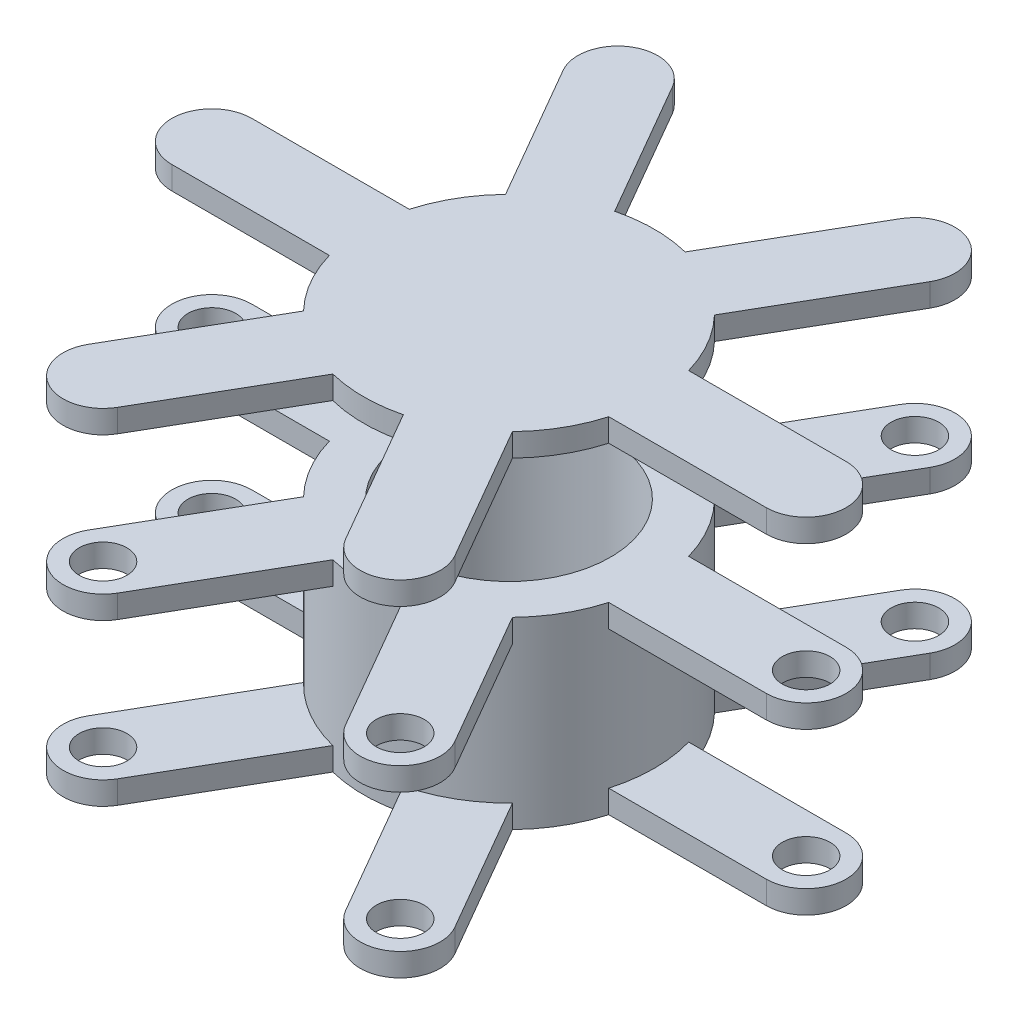
from build123d import *

# Parameters (mm, degrees)
SKETCH1_R           = 44.14652409
BOSS_EXTRUDE1_DEPTH = 70
SKETCH1_3_R         = 10.392805584
BOSS_EXTRUDE2_DEPTH = 10
SKETCH5_R           = 10.392805584
SKETCH5_R_2         = 44.14652409
BOSS_EXTRUDE5_DEPTH = 10
BOSS_EXTRUDE6_DEPTH = 10


with BuildPart() as part:
    # Sketch1 → Boss-Extrude1 (new body)
    with BuildSketch(Plane(origin=(0, 0, 0), x_dir=(1, 0, 0), z_dir=(0, 1, 0))):
        with BuildLine():
            ThreePointArc((63.229635805, 0), (62.617211108, 8.779049896), (60.791800569, 17.388036912))
            ThreePointArc((60.791800569, 17.388036912), (54.7582109, 31.615268195), (45.453659087, 43.953972739))
            ThreePointArc((45.453659087, 43.953972739), (31.614367608, 54.758730854), (15.337418597, 61.34126209))
            ThreePointArc((15.337418597, 61.34126209), (-0.000519954, 63.229635803), (-15.338427446, 61.341009834))
            ThreePointArc((-15.338427446, 61.341009834), (-31.615268195, 54.7582109), (-45.454381972, 43.953225178))
            ThreePointArc((-45.454381972, 43.953225178), (-54.758730854, 31.614367608), (-60.792086533, 17.387037095))
            ThreePointArc((-60.792086533, 17.387037095), (-63.229635803, -0.000519954), (-60.791800569, -17.388036912))
            ThreePointArc((-60.791800569, -17.388036912), (-54.7582109, -31.615268195), (-45.453659087, -43.953972739))
            ThreePointArc((-45.453659087, -43.953972739), (-31.614367608, -54.758730854), (-15.337418597, -61.34126209))
            ThreePointArc((-15.337418597, -61.34126209), (0.000519954, -63.229635803), (15.338427446, -61.341009834))
            ThreePointArc((15.338427446, -61.341009834), (31.615268195, -54.7582109), (45.454381972, -43.953225178))
            ThreePointArc((45.454381972, -43.953225178), (54.758730854, -31.614367608), (60.792086533, -17.387037095))
            ThreePointArc((60.792086533, -17.387037095), (62.617283298, -8.778534977), (63.229635805, 0))
        make_face()
        Circle(SKETCH1_R, mode=Mode.SUBTRACT)
    extrude(amount=BOSS_EXTRUDE1_DEPTH)

    # Sketch1<3> → Boss-Extrude2 (add)
    # profile 1 of 6: a face of its own
    with BuildSketch(Plane(origin=(0, 0, 0), x_dir=(1, 0, 0), z_dir=(0, 1, 0))):
        with BuildLine():
            Line((129.314910219, 17.388036912), (60.791800569, 17.388036912))
            ThreePointArc((60.791800569, 17.388036912), (63.229635803, 0.000519954), (60.792086533, -17.387037095))
            Line((60.792086533, -17.387037095), (129.501373917, -17.387037095))
            ThreePointArc((129.501373917, -17.387037095), (146.702697175, 0.093233189), (129.314910219, 17.388036912))
        make_face()
        with Locations((129.314910219, 0)):
            Circle(SKETCH1_3_R, mode=Mode.SUBTRACT)
    # profile 2 of 6: a face of its own
    with BuildSketch(Plane(origin=(0, 0, 0), x_dir=(1, 0, 0), z_dir=(0, 1, 0))):
        with BuildLine():
            ThreePointArc((15.337418597, 61.34126209), (31.614367608, 54.758730854), (45.453659087, 43.953972739))
            Line((45.453659087, 43.953972739), (79.808302779, 103.45796109))
            ThreePointArc((79.808302779, 103.45796109), (73.270606277, 127.094879152), (49.598973422, 120.684015794))
            Line((49.598973422, 120.684015794), (15.337418597, 61.34126209))
        make_face()
        with Locations((64.65745511, 111.989997338)):
            Circle(SKETCH1_3_R, mode=Mode.SUBTRACT)
    # profile 3 of 6: a face of its own
    with BuildSketch(Plane(origin=(0, 0, 0), x_dir=(1, 0, 0), z_dir=(0, 1, 0))):
        with BuildLine():
            Line((79.715936797, -103.295978882), (45.454381972, -43.953225178))
            ThreePointArc((45.454381972, -43.953225178), (31.615268195, -54.7582109), (15.338427446, -61.341009834))
            Line((15.338427446, -61.341009834), (49.693071138, -120.844998185))
            ThreePointArc((49.693071138, -120.844998185), (73.432090898, -127.001645963), (79.715936797, -103.295978882))
        make_face()
        with Locations((64.65745511, -111.989997338)):
            Circle(SKETCH1_3_R, mode=Mode.SUBTRACT)
    # profile 4 of 6: a face of its own
    with BuildSketch(Plane(origin=(0, 0, 0), x_dir=(1, 0, 0), z_dir=(0, 1, 0))):
        with BuildLine():
            ThreePointArc((-45.454381972, 43.953225178), (-31.615268195, 54.7582109), (-15.338427446, 61.341009834))
            Line((-15.338427446, 61.341009834), (-49.693071138, 120.844998185))
            ThreePointArc((-49.693071138, 120.844998185), (-73.432090898, 127.001645963), (-79.715936797, 103.295978882))
            Line((-79.715936797, 103.295978882), (-45.454381972, 43.953225178))
        make_face()
        with Locations((-64.65745511, 111.989997338)):
            Circle(SKETCH1_3_R, mode=Mode.SUBTRACT)
    # profile 5 of 6: a face of its own
    with BuildSketch(Plane(origin=(0, 0, 0), x_dir=(1, 0, 0), z_dir=(0, 1, 0))):
        with BuildLine():
            Line((-49.598973422, -120.684015794), (-15.337418597, -61.34126209))
            ThreePointArc((-15.337418597, -61.34126209), (-31.614367608, -54.758730854), (-45.453659087, -43.953972739))
            Line((-45.453659087, -43.953972739), (-79.808302779, -103.45796109))
            ThreePointArc((-79.808302779, -103.45796109), (-73.270606277, -127.094879152), (-49.598973422, -120.684015794))
        make_face()
        with Locations((-64.65745511, -111.989997338)):
            Circle(SKETCH1_3_R, mode=Mode.SUBTRACT)
    # profile 6 of 6: a face of its own
    with BuildSketch(Plane(origin=(0, 0, 0), x_dir=(1, 0, 0), z_dir=(0, 1, 0))):
        with BuildLine():
            ThreePointArc((-60.791800569, -17.388036912), (-63.229635803, -0.000519954), (-60.792086533, 17.387037095))
            Line((-60.792086533, 17.387037095), (-129.501373917, 17.387037095))
            ThreePointArc((-129.501373917, 17.387037095), (-146.702697175, -0.093233189), (-129.314910219, -17.388036912))
            Line((-129.314910219, -17.388036912), (-60.791800569, -17.388036912))
        make_face()
        with Locations((-129.314910219, 0)):
            Circle(SKETCH1_3_R, mode=Mode.SUBTRACT)
    extrude(amount=BOSS_EXTRUDE2_DEPTH)

    # Sketch5 → Boss-Extrude5 (add)
    with BuildSketch(Plane(origin=(0, 70, 0), x_dir=(1, 0, 0), z_dir=(0, 1, 0))):
        with BuildLine():
            ThreePointArc((-49.693071138, 120.844998185), (-73.432090898, 127.001645963), (-79.715936797, 103.295978882))
            Line((-79.715936797, 103.295978882), (-45.454381972, 43.953225178))
            ThreePointArc((-45.454381972, 43.953225178), (-54.758730854, 31.614367608), (-60.792086533, 17.387037095))
            Line((-60.792086533, 17.387037095), (-129.501373917, 17.387037095))
            ThreePointArc((-129.501373917, 17.387037095), (-146.702697175, -0.093233189), (-129.314910219, -17.388036912))
            Line((-129.314910219, -17.388036912), (-60.791800569, -17.388036912))
            ThreePointArc((-60.791800569, -17.388036912), (-54.7582109, -31.615268195), (-45.453659087, -43.953972739))
            Line((-45.453659087, -43.953972739), (-79.808302779, -103.45796109))
            ThreePointArc((-79.808302779, -103.45796109), (-73.270606277, -127.094879152), (-49.598973422, -120.684015794))
            Line((-49.598973422, -120.684015794), (-15.337418597, -61.34126209))
            ThreePointArc((-15.337418597, -61.34126209), (0.000519954, -63.229635803), (15.338427446, -61.341009834))
            Line((15.338427446, -61.341009834), (49.693071138, -120.844998185))
            ThreePointArc((49.693071138, -120.844998185), (73.432090898, -127.001645963), (79.715936797, -103.295978882))
            Line((79.715936797, -103.295978882), (45.454381972, -43.953225178))
            ThreePointArc((45.454381972, -43.953225178), (54.758730854, -31.614367608), (60.792086533, -17.387037095))
            Line((60.792086533, -17.387037095), (129.501373917, -17.387037095))
            ThreePointArc((129.501373917, -17.387037095), (146.702697175, 0.093233189), (129.314910219, 17.388036912))
            Line((129.314910219, 17.388036912), (60.791800569, 17.388036912))
            ThreePointArc((60.791800569, 17.388036912), (54.7582109, 31.615268195), (45.453659087, 43.953972739))
            Line((45.453659087, 43.953972739), (79.808302779, 103.45796109))
            ThreePointArc((79.808302779, 103.45796109), (73.270606277, 127.094879152), (49.598973422, 120.684015794))
            Line((49.598973422, 120.684015794), (15.337418597, 61.34126209))
            ThreePointArc((15.337418597, 61.34126209), (-0.000519954, 63.229635803), (-15.338427446, 61.341009834))
            Line((-15.338427446, 61.341009834), (-49.693071138, 120.844998185))
        make_face()
        with Locations((-64.65745511, 111.989997338)):
            Circle(SKETCH5_R, mode=Mode.SUBTRACT)
        Circle(SKETCH5_R_2, mode=Mode.SUBTRACT)
        with Locations((64.65745511, 111.989997338)):
            Circle(SKETCH5_R, mode=Mode.SUBTRACT)
        with Locations((129.314910219, 0)):
            Circle(SKETCH5_R, mode=Mode.SUBTRACT)
        with Locations((64.65745511, -111.989997338)):
            Circle(SKETCH5_R, mode=Mode.SUBTRACT)
        with Locations((-64.65745511, -111.989997338)):
            Circle(SKETCH5_R, mode=Mode.SUBTRACT)
        with Locations((-129.314910219, 0)):
            Circle(SKETCH5_R, mode=Mode.SUBTRACT)
    extrude(amount=BOSS_EXTRUDE5_DEPTH)


with BuildPart() as body_2:
    # Sketch6 → Boss-Extrude6 (new body)
    with BuildSketch(Plane(origin=(0, 140, 0), x_dir=(1, 0, 0), z_dir=(0, 1, 0))):
        with BuildLine():
            Line((15.338427446, -61.341009834), (49.693071138, -120.844998185))
            ThreePointArc((49.693071138, -120.844998185), (73.432090898, -127.001645963), (79.715936797, -103.295978882))
            Line((79.715936797, -103.295978882), (45.454381972, -43.953225178))
            ThreePointArc((45.454381972, -43.953225178), (54.758730854, -31.614367608), (60.792086533, -17.387037095))
            Line((60.792086533, -17.387037095), (129.501373917, -17.387037095))
            ThreePointArc((129.501373917, -17.387037095), (146.702697175, 0.093233189), (129.314910219, 17.388036912))
            Line((129.314910219, 17.388036912), (60.791800569, 17.388036912))
            ThreePointArc((60.791800569, 17.388036912), (54.7582109, 31.615268195), (45.453659087, 43.953972739))
            Line((45.453659087, 43.953972739), (79.808302779, 103.45796109))
            ThreePointArc((79.808302779, 103.45796109), (73.270606277, 127.094879152), (49.598973422, 120.684015794))
            Line((49.598973422, 120.684015794), (15.337418597, 61.34126209))
            ThreePointArc((15.337418597, 61.34126209), (-0.000519954, 63.229635803), (-15.338427446, 61.341009834))
            Line((-15.338427446, 61.341009834), (-49.693071138, 120.844998185))
            ThreePointArc((-49.693071138, 120.844998185), (-73.432090898, 127.001645963), (-79.715936797, 103.295978882))
            Line((-79.715936797, 103.295978882), (-45.454381972, 43.953225178))
            ThreePointArc((-45.454381972, 43.953225178), (-54.758730854, 31.614367608), (-60.792086533, 17.387037095))
            Line((-60.792086533, 17.387037095), (-129.501373917, 17.387037095))
            ThreePointArc((-129.501373917, 17.387037095), (-146.702697175, -0.093233189), (-129.314910219, -17.388036912))
            Line((-129.314910219, -17.388036912), (-60.791800569, -17.388036912))
            ThreePointArc((-60.791800569, -17.388036912), (-54.7582109, -31.615268195), (-45.453659087, -43.953972739))
            Line((-45.453659087, -43.953972739), (-79.808302779, -103.45796109))
            ThreePointArc((-79.808302779, -103.45796109), (-73.270606277, -127.094879152), (-49.598973422, -120.684015794))
            Line((-49.598973422, -120.684015794), (-15.337418597, -61.34126209))
            ThreePointArc((-15.337418597, -61.34126209), (0.000519954, -63.229635803), (15.338427446, -61.341009834))
        make_face()
    extrude(amount=BOSS_EXTRUDE6_DEPTH)


solid = Compound([part.part, body_2.part])
